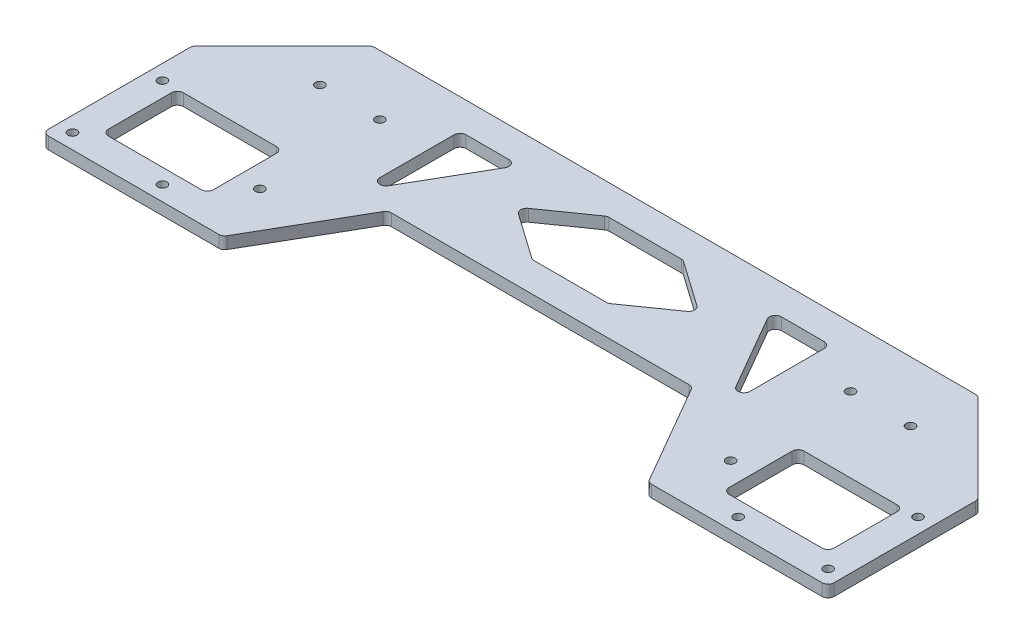
from build123d import *

# Parameters (mm, degrees)
EXTRUDE_1_DEPTH     = 4
CUT_EXTRUDE_1_DEPTH = 4
CUT_EXTRUDE_2_DEPTH = 4
CUT_EXTRUDE_3_DEPTH = 4
FILLET_1_R          = 2
FILLET_2_R          = 2
SKETCH_5_R          = 1.5
CUT_EXTRUDE_4_DEPTH = 4
SKETCH_6_R          = 1.5
CUT_EXTRUDE_5_DEPTH = 4
SKETCH_7_R          = 1.5
CUT_EXTRUDE_6_DEPTH = 4
SKETCH_8_R          = 1.5
CUT_EXTRUDE_7_DEPTH = 4
SKETCH_9_R          = 1.5
CUT_EXTRUDE_8_DEPTH = 4
FILLET_3_R          = 2


with BuildPart() as part:
    # 草图1 → 凸台-拉伸1 (new body)
    with BuildSketch(Plane(origin=(0, 0, 0), x_dir=(1, 0, 0), z_dir=(0, 1, 0))):
        Polygon((65.54875717, -39.671128107), (125.54875717, -39.671128107), (125.54875717, 10.328871893), (95.54875717, 40.328871893), (-106.45124283, 40.328871893), (-136.45124283, 10.328871893), (-136.45124283, -39.671128107), (-76.45124283, -39.671128107), (-56.243983408, -4.671128107), (45.341497749, -4.671128107), align=None)
    extrude(amount=EXTRUDE_1_DEPTH)

    # 草图2 → 切除-拉伸1 (cut)
    with BuildSketch(Plane(origin=(0, 4, 0), x_dir=(1, 0, 0), z_dir=(0, 1, 0))):
        Polygon((7.216878365, 30.328871893), (-18.119364025, 30.328871893), (-35.90248566, 17.828871893), (-18.119364025, 5.328871893), (7.216878365, 5.328871893), (25, 17.828871893), align=None)
    extrude(amount=-CUT_EXTRUDE_1_DEPTH, mode=Mode.SUBTRACT)

    # 草图3 → 切除-拉伸2 (cut)
    with BuildSketch(Plane(origin=(0, 4, 0), x_dir=(1, 0, 0), z_dir=(0, 1, 0))):
        Polygon((-67.177653117, 30.328871893), (-47.429348489, 30.328871893), (-67.177653117, -3.876195086), align=None)
        Polygon((56.275167457, -3.876195086), (56.275167457, 30.328871893), (36.52686283, 30.328871893), align=None)
    extrude(amount=-CUT_EXTRUDE_2_DEPTH, mode=Mode.SUBTRACT)

    # 草图4 → 切除-拉伸3 (cut)
    with BuildSketch(Plane(origin=(0, 4, 0), x_dir=(1, 0, 0), z_dir=(0, 1, 0))):
        with BuildLine():
            Line((-124.45124283, -29.671128107), (-93.45124283, -29.671128107))
            ThreePointArc((-93.45124283, -29.671128107), (-92.037029267, -29.085341669), (-91.45124283, -27.671128107))
            Line((-91.45124283, -27.671128107), (-91.45124283, -6.671128107))
            ThreePointArc((-91.45124283, -6.671128107), (-92.037029267, -5.256914545), (-93.45124283, -4.671128107))
            Line((-93.45124283, -4.671128107), (-124.45124283, -4.671128107))
            ThreePointArc((-124.45124283, -4.671128107), (-125.865456392, -5.256914545), (-126.45124283, -6.671128107))
            Line((-126.45124283, -6.671128107), (-126.45124283, -27.671128107))
            ThreePointArc((-126.45124283, -27.671128107), (-125.865456392, -29.085341669), (-124.45124283, -29.671128107))
        make_face()
        with BuildLine():
            Line((115.54875717, -27.671128107), (115.54875717, -6.671128107))
            ThreePointArc((115.54875717, -6.671128107), (114.962970733, -5.256914545), (113.54875717, -4.671128107))
            Line((113.54875717, -4.671128107), (82.54875717, -4.671128107))
            ThreePointArc((82.54875717, -4.671128107), (81.134543608, -5.256914545), (80.54875717, -6.671128107))
            Line((80.54875717, -6.671128107), (80.54875717, -27.671128107))
            ThreePointArc((80.54875717, -27.671128107), (81.134543608, -29.085341669), (82.54875717, -29.671128107))
            Line((82.54875717, -29.671128107), (113.54875717, -29.671128107))
            ThreePointArc((113.54875717, -29.671128107), (114.962970733, -29.085341669), (115.54875717, -27.671128107))
        make_face()
    extrude(amount=-CUT_EXTRUDE_3_DEPTH, mode=Mode.SUBTRACT)

    # 圆角1
    fillet_1_edges = [part.edges().sort_by_distance(p)[0] for p in [
        (-67.177653117, 2, 3.876195086),
        (-67.177653117, 2, -30.328871893),
        (-47.429348489, 2, -30.328871893),
        (56.275167457, 2, 3.876195086),
        (36.52686283, 2, -30.328871893),
        (56.275167457, 2, -30.328871893),
    ]]
    fillet(fillet_1_edges, radius=FILLET_1_R)

    # 圆角2
    fillet_2_edges = [part.edges().sort_by_distance(p)[0] for p in [
        (-136.45124283, 2, -10.328871893),
        (-106.45124283, 2, -40.328871893),
        (95.54875717, 2, -40.328871893),
        (125.54875717, 2, -10.328871893),
        (125.54875717, 2, 39.671128107),
        (65.54875717, 2, 39.671128107),
        (45.341497749, 2, 4.671128107),
        (-56.243983408, 2, 4.671128107),
        (-76.45124283, 2, 39.671128107),
        (-136.45124283, 2, 39.671128107),
    ]]
    fillet(fillet_2_edges, radius=FILLET_2_R)

    # 草图5 → 切除-拉伸4 (cut)
    with BuildSketch(Plane(origin=(0, 4, 0), x_dir=(1, 0, 0), z_dir=(0, 1, 0))):
        with Locations(Location((73.04875717, -19.671128107, 0), (0, 0, 270))):
            Circle(SKETCH_5_R)
        with Locations(Location((73.04875717, 20.328871893, 0), (0, 0, 270))):
            Circle(SKETCH_5_R)
        with Locations(Location((-83.95124283, -19.671128107, 0), (0, 0, 90))):
            Circle(SKETCH_5_R)
        with Locations(Location((-83.95124283, 20.328871893, 0), (0, 0, 90))):
            Circle(SKETCH_5_R)
    extrude(amount=-CUT_EXTRUDE_4_DEPTH, mode=Mode.SUBTRACT)

    # 草图6 → 切除-拉伸5 (cut)
    with BuildSketch(Plane(origin=(0, 4, 0), x_dir=(1, 0, 0), z_dir=(0, 1, 0))):
        with Locations(Location((120.54875717, -34.671128107, 0), (0, 0, 270))):
            Circle(SKETCH_6_R)
        with Locations(Location((93.04875717, 20.328871893, 0), (0, 0, 270))):
            Circle(SKETCH_6_R)
        with Locations(Location((90.54875717, -34.671128107, 0), (0, 0, 270))):
            Circle(SKETCH_6_R)
    extrude(amount=-CUT_EXTRUDE_5_DEPTH, mode=Mode.SUBTRACT)

    # 草图7 → 切除-拉伸6 (cut)
    with BuildSketch(Plane(origin=(0, 4, 0), x_dir=(1, 0, 0), z_dir=(0, 1, 0))):
        with Locations(Location((120.54875717, -4.671128107, 0), (0, 0, 270))):
            Circle(SKETCH_7_R)
    extrude(amount=-CUT_EXTRUDE_6_DEPTH, mode=Mode.SUBTRACT)

    # 草图8 → 切除-拉伸7 (cut)
    with BuildSketch(Plane(origin=(0, 4, 0), x_dir=(1, 0, 0), z_dir=(0, 1, 0))):
        with Locations(Location((-131.45124283, -34.671128107, 0), (0, 0, 270))):
            Circle(SKETCH_8_R)
        with Locations(Location((-101.45124283, -34.671128107, 0), (0, 0, 270))):
            Circle(SKETCH_8_R)
        with Locations(Location((-131.45124283, -4.671128107, 0), (0, 0, 270))):
            Circle(SKETCH_8_R)
    extrude(amount=-CUT_EXTRUDE_7_DEPTH, mode=Mode.SUBTRACT)

    # 草图9 → 切除-拉伸8 (cut)
    with BuildSketch(Plane(origin=(0, 4, 0), x_dir=(1, 0, 0), z_dir=(0, 1, 0))):
        with Locations(Location((-103.95124283, 20.328871893, 0), (0, 0, 270))):
            Circle(SKETCH_9_R)
    extrude(amount=-CUT_EXTRUDE_8_DEPTH, mode=Mode.SUBTRACT)

    # 圆角3
    fillet_3_edges = [part.edges().sort_by_distance(p)[0] for p in [
        (7.216878365, 2, -30.328871893),
        (25, 2, -17.828871893),
        (7.216878365, 2, -5.328871893),
        (-18.119364025, 2, -5.328871893),
        (-35.90248566, 2, -17.828871893),
        (-18.119364025, 2, -30.328871893),
    ]]
    fillet(fillet_3_edges, radius=FILLET_3_R)


solid = part.part
